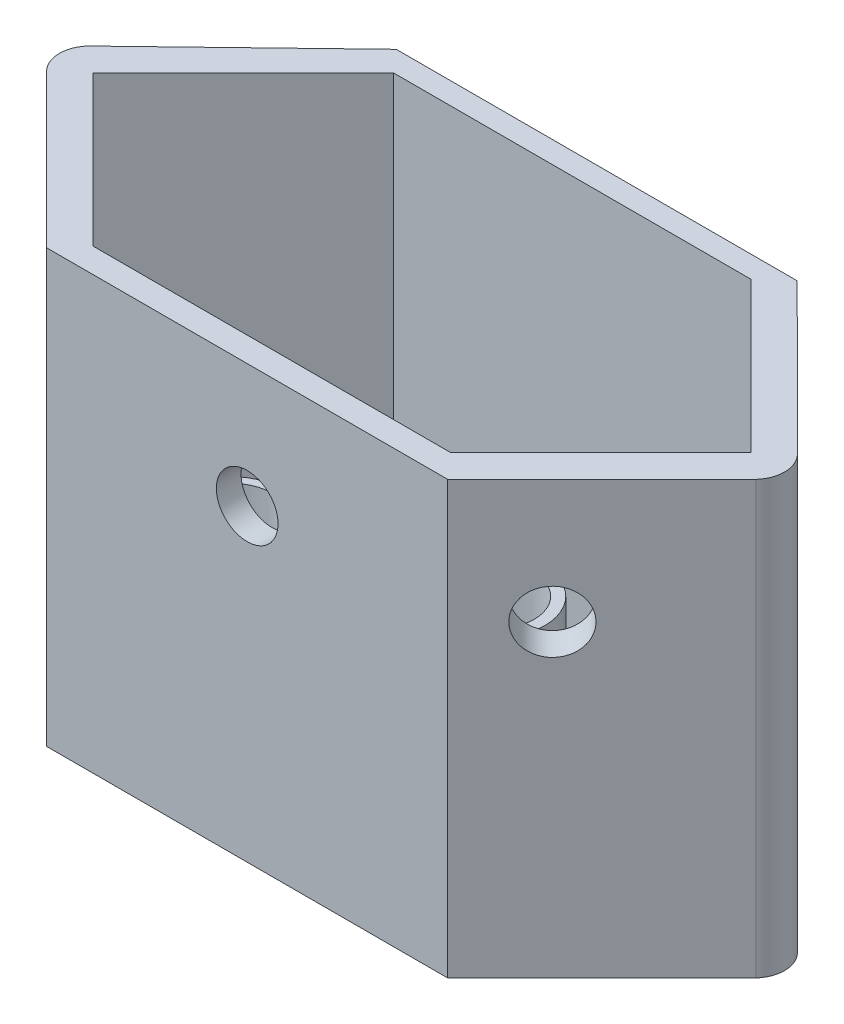
from build123d import *

# Parameters (mm, degrees)
RESSALTO_EXTRUS_O3_DEPTH  = 25
CORTE_EXTRUS_O1_DEPTH     = 23.8
ESBO_O5_R                 = 1.95
CORTE_EXTRUS_O2_DEPTH     = 23.8
CORTE_EXTRUS_O3_DEPTH     = 23.8
RESSALTO_EXTRUS_O11_START = 4
ESBO_O9_R                 = 2.35
ESBO_O9_R_2               = 1.95
ESBO_O9_R_3               = 2.468896698
RESSALTO_EXTRUS_O11_DEPTH = 4
ESBO_O11_W                = 83.094173182
ESBO_O11_H                = 8
CORTE_EXTRUS_O10_DEPTH    = 30
ESBO_O19_R                = 1.5
CORTE_EXTRUS_O12_DEPTH    = 30
ESBO_O22_R                = 1.5
CORTE_EXTRUS_O13_DEPTH    = 30
ESBO_O23_R                = 1.5
CORTE_EXTRUS_O14_DEPTH    = 30


with BuildPart() as part:
    # Esboço1 → Ressalto-extrusão3 (new body)
    with BuildSketch(Plane(origin=(0, 0, 0), x_dir=(1, 0, 0), z_dir=(0, 1, 0))):
        with BuildLine():
            Line((9.888111981, 8.359296796), (-9.611888019, 8.359296796))
            Line((-9.611888019, 8.359296796), (-17.250307666, 0.999703565))
            ThreePointArc((-17.250307666, 0.999703565), (-17.631966883, 0.000271602), (-17.250692692, -0.999307308))
            Line((-17.250692692, -0.999307308), (-9.75, -8.5))
            Line((-9.75, -8.5), (9.75, -8.5))
            Line((9.75, -8.5), (17.25, -1))
            ThreePointArc((17.25, -1), (17.631966011, 0), (17.25, 1))
            Line((17.25, 1), (9.888111981, 8.359296796))
        make_face()
    extrude(amount=RESSALTO_EXTRUS_O3_DEPTH)

    # Esboço4 → Corte-extrusão1 (cut)
    with BuildSketch(Plane(origin=(0, 25, 0), x_dir=(1, 0, 0), z_dir=(0, 1, 0))):
        Polygon((8.55, 7.3), (-8.55, 7.3), (-15.85, 0), (-8.55, -7.3), (8.55, -7.3), (15.85, 0), align=None)
    extrude(amount=-CORTE_EXTRUS_O1_DEPTH, mode=Mode.SUBTRACT)

    # Esboço5 → Corte-extrusão2 (cut)
    with BuildSketch(Plane(origin=(0, 1.2, 0), x_dir=(1, 0, 0), z_dir=(0, 1, 0))):
        with Locations((0, 3.5)):
            Circle(ESBO_O5_R)
        with Locations((-9.75, 0.5)):
            Circle(ESBO_O5_R)
        with Locations((9.75, 0.5)):
            Circle(ESBO_O5_R)
    extrude(amount=-CORTE_EXTRUS_O2_DEPTH, mode=Mode.SUBTRACT)

    # Esboço7 → Corte-extrusão3 (cut)
    with BuildSketch(Plane(origin=(0, 25, 0), x_dir=(1, 0, 0), z_dir=(0, 1, 0))):
        Polygon((-15.85, 0), (-8.55, 7.3), (-8.691421356, 7.3), (-15.991421356, 0), (-8.691421356, -7.3), (-8.55, -7.3), align=None)
        Polygon((8.691421356, -7.3), (15.991421356, 0), (8.691421356, 7.3), (8.55, 7.3), (15.85, 0), (8.55, -7.3), align=None)
    extrude(amount=-CORTE_EXTRUS_O3_DEPTH, mode=Mode.SUBTRACT)

    # Esboço9 → Ressalto-extrusão11 (add)
    # profile 1 of 3: a face of its own
    with BuildSketch(Plane(origin=(0, 1.2, 0), x_dir=(1, 0, 0), z_dir=(0, 1, 0)).offset(RESSALTO_EXTRUS_O11_START)):
        with Locations((-9.75, 0.5)):
            Circle(ESBO_O9_R)
        with Locations((-9.75, 0.5)):
            Circle(ESBO_O9_R_2, mode=Mode.SUBTRACT)
    # profile 2 of 3: a face of its own
    with BuildSketch(Plane(origin=(0, 1.2, 0), x_dir=(1, 0, 0), z_dir=(0, 1, 0)).offset(RESSALTO_EXTRUS_O11_START)):
        with Locations((0, 3.5)):
            Circle(ESBO_O9_R_3)
        with Locations((0, 3.5)):
            Circle(ESBO_O9_R_2, mode=Mode.SUBTRACT)
    # profile 3 of 3: a face of its own
    with BuildSketch(Plane(origin=(0, 1.2, 0), x_dir=(1, 0, 0), z_dir=(0, 1, 0)).offset(RESSALTO_EXTRUS_O11_START)):
        with Locations((9.75, 0.5)):
            Circle(ESBO_O9_R)
        with Locations((9.75, 0.5)):
            Circle(ESBO_O9_R_2, mode=Mode.SUBTRACT)
    extrude(amount=-RESSALTO_EXTRUS_O11_DEPTH)

    # Esboço11 → Corte-extrusão10 (cut)
    with BuildSketch(Plane.XY.offset(8.5)):
        with Locations((0, 25)):
            Rectangle(ESBO_O11_W, ESBO_O11_H)
    extrude(amount=-CORTE_EXTRUS_O10_DEPTH, mode=Mode.SUBTRACT)

    # Esboço19 → Corte-extrusão12 (cut)
    with BuildSketch(Plane(origin=(7.995710678, 0, 7.995710678), x_dir=(-0.7071067811865476, 0, 0.7071067811865476), z_dir=(-0.7071067811865476, 0, -0.7071067811865476))):
        with Locations((-4.483883476, 15)):
            Circle(ESBO_O19_R)
    extrude(amount=-CORTE_EXTRUS_O12_DEPTH, mode=Mode.SUBTRACT)

    # Esboço22 → Corte-extrusão13 (cut)
    with BuildSketch(Plane(origin=(0, 0, 7.3), x_dir=(-1, 0, 0), z_dir=(0, 0, -1))):
        with Locations((0, 15)):
            Circle(ESBO_O22_R)
    extrude(amount=-CORTE_EXTRUS_O13_DEPTH, mode=Mode.SUBTRACT)

    # Esboço23 → Corte-extrusão14 (cut)
    with BuildSketch(Plane(origin=(-7.995710678, 0, 7.995710678), x_dir=(-0.7071067811865476, 0, -0.7071067811865475), z_dir=(0.7071067811865475, 0, -0.7071067811865476))):
        with Locations((4.683883476, 15)):
            Circle(ESBO_O23_R)
    extrude(amount=-CORTE_EXTRUS_O14_DEPTH, mode=Mode.SUBTRACT)


solid = part.part
